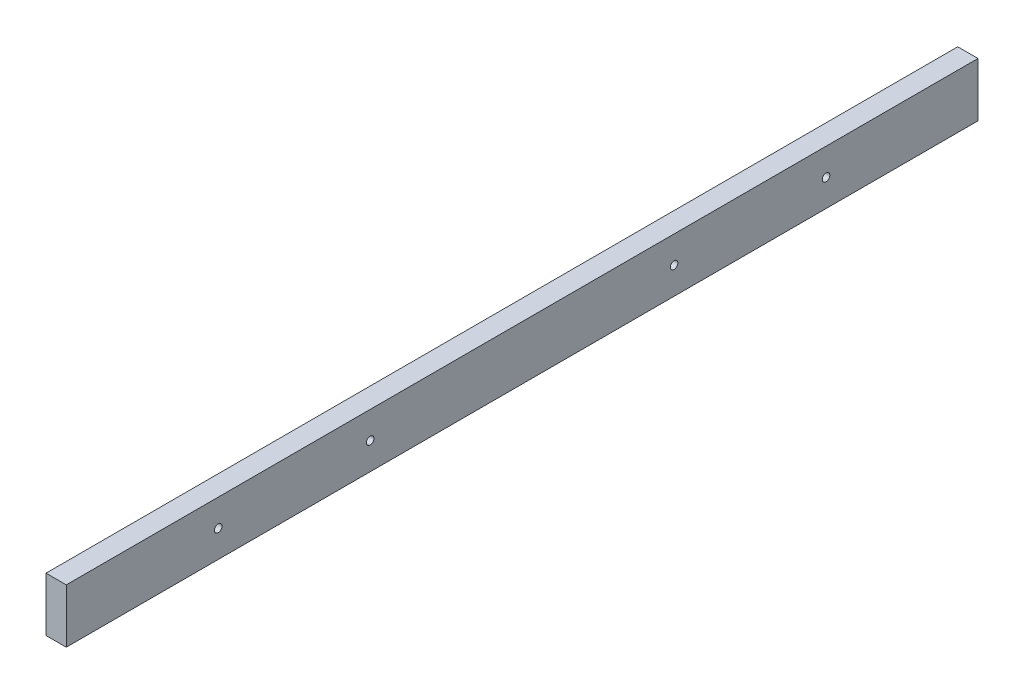
from build123d import *

# Parameters (mm, degrees)
SKETCH1_W           = 6
SKETCH1_H           = 270
BOSS_EXTRUDE1_DEPTH = 16
SKETCH2_R           = 1.125
CUT_EXTRUDE1_DEPTH  = 10


with BuildPart() as part:
    # Sketch1 → Boss-Extrude1 (new body)
    with BuildSketch(Plane(origin=(0, 0, 0), x_dir=(1, 0, 0), z_dir=(0, 1, 0))):
        Rectangle(SKETCH1_W, SKETCH1_H)
    extrude(amount=BOSS_EXTRUDE1_DEPTH)

    # Sketch2 → Cut-Extrude1 (cut)
    with BuildSketch(Plane(origin=(3, 0, 0), x_dir=(0, 0, -1), z_dir=(1, 0, 0))):
        with Locations((-90, 8)):
            Circle(SKETCH2_R)
        with Locations((90, 8)):
            Circle(SKETCH2_R)
        with Locations((-45, 8)):
            Circle(SKETCH2_R)
        with Locations((45, 8)):
            Circle(SKETCH2_R)
    extrude(amount=-CUT_EXTRUDE1_DEPTH, mode=Mode.SUBTRACT)


solid = part.part
